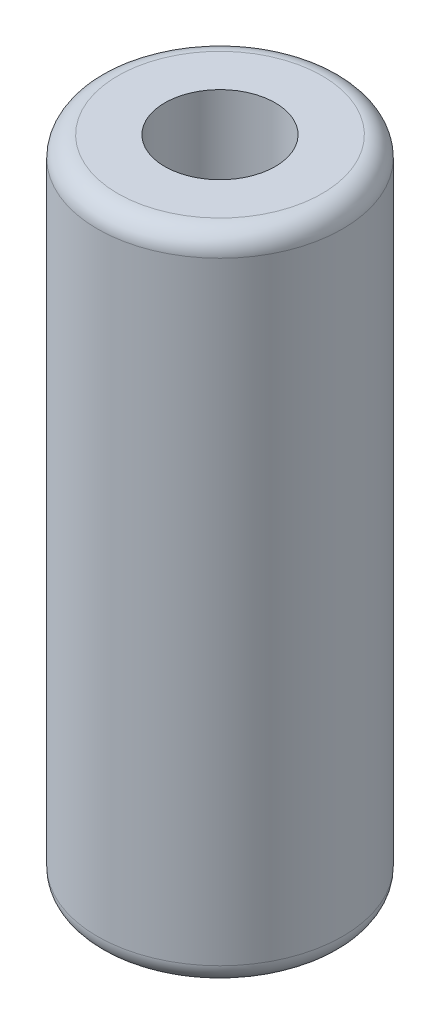
from build123d import *

# Parameters (mm, degrees)
BOSS_EXTRUDE1_DEPTH       = 8
BOSS_EXTRUDE1_DEPTH_BACK  = 8
SKETCH1_R                 = 3
F_6_32_TAPPED_HOLE1_D     = 2.7051
F_6_32_TAPPED_HOLE1_DEPTH = 7
F_6_32_TAPPED_HOLE1_TIP   = 0.81269403
F_6_32_TAPPED_HOLE2_D     = 2.7051
F_6_32_TAPPED_HOLE2_DEPTH = 7
F_6_32_TAPPED_HOLE2_TIP   = 0.81269403
FILLET1_R                 = 0.5


with BuildPart() as part:
    # Sketch1 → Boss-Extrude1 (new, two sides: drawn at the far end of the back side and taken through both)
    with BuildSketch(Plane(origin=(0, 0, 0), x_dir=(1, 0, 0), z_dir=(0, 1, 0)).offset(-BOSS_EXTRUDE1_DEPTH_BACK)):
        Circle(SKETCH1_R)
    extrude(amount=BOSS_EXTRUDE1_DEPTH + BOSS_EXTRUDE1_DEPTH_BACK)

    # #6-32 Tapped Hole1
    with Locations(Plane(origin=(0, 8, 0), x_dir=(1, 0, 0), z_dir=(0, 1, 0))):
        with Locations((0, 0)):
            Hole(F_6_32_TAPPED_HOLE1_D / 2, depth=F_6_32_TAPPED_HOLE1_DEPTH)
            with Locations((0, 0, -(F_6_32_TAPPED_HOLE1_DEPTH + F_6_32_TAPPED_HOLE1_TIP / 2))):  # 118° drill point
                Cone(0, F_6_32_TAPPED_HOLE1_D / 2, F_6_32_TAPPED_HOLE1_TIP, mode=Mode.SUBTRACT)

    # #6-32 Tapped Hole2
    with Locations(Plane(origin=(0, -8, 0), x_dir=(-1, 0, 0), z_dir=(0, -1, 0))):
        with Locations((0, 0)):
            Hole(F_6_32_TAPPED_HOLE2_D / 2, depth=F_6_32_TAPPED_HOLE2_DEPTH)
            with Locations((0, 0, -(F_6_32_TAPPED_HOLE2_DEPTH + F_6_32_TAPPED_HOLE2_TIP / 2))):  # 118° drill point
                Cone(0, F_6_32_TAPPED_HOLE2_D / 2, F_6_32_TAPPED_HOLE2_TIP, mode=Mode.SUBTRACT)

    # Fillet1
    fillet1_edges = [part.edges().sort_by_distance(p)[0] for p in [
        (-3, -8, 0),
        (-3, 8, 0),
    ]]
    fillet(fillet1_edges, radius=FILLET1_R)


solid = part.part
